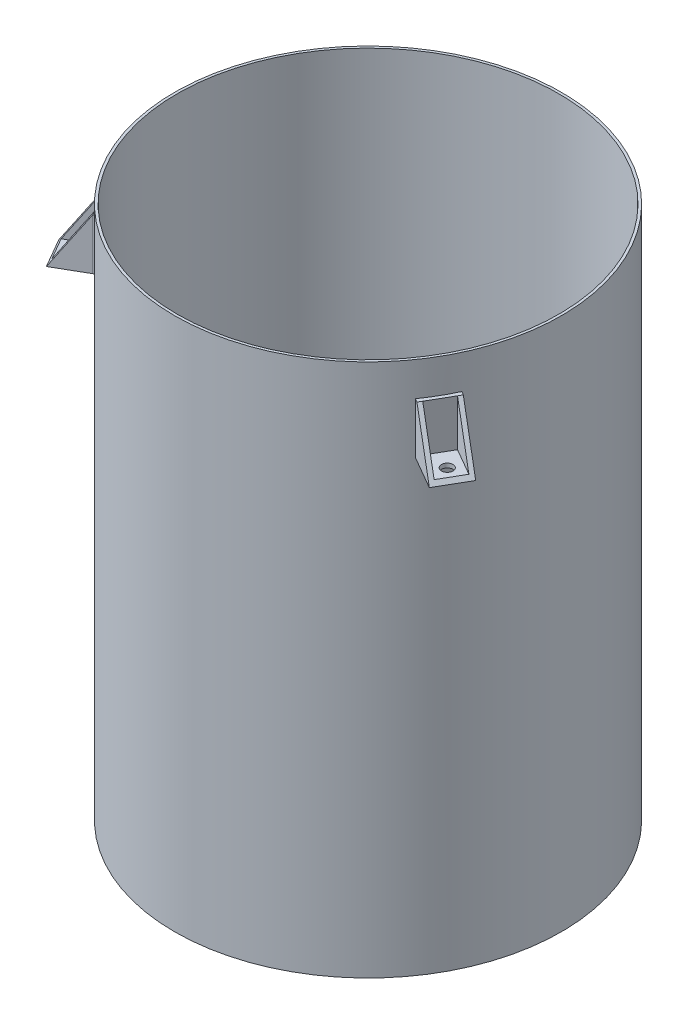
from build123d import *

# Parameters (mm, degrees)
SKETCH1_R                       = 228
SKETCH1_R_2                     = 225
BOSS_EXTRUDE1_DEPTH             = 628.8
SKETCH5_R                       = 28
SKETCH5_R_2                     = 25
BOSS_EXTRUDE2_DEPTH             = 50
BOSS_EXTRUDE2_DIRECTION_2_REACH = 753.49
BOSS_EXTRUDE3_DEPTH             = 60
BOSS_EXTRUDE4_DEPTH             = 40
CUT_EXTRUDE1_DEPTH              = 40
CIRPATTERN1_COUNT               = 3
SKETCH10_R                      = 6.75
CUT_EXTRUDE2_DEPTH              = 40


with BuildPart() as part:
    # Sketch1 → Boss-Extrude1 (new body)
    with BuildSketch(Plane(origin=(0, 0, 0), x_dir=(1, 0, 0), z_dir=(0, 1, 0))):
        with Locations(Location((0, 0, 0), (0, 0, 270))):
            Circle(SKETCH1_R)
        with Locations(Location((0, 0, 0), (0, 0, 270))):
            Circle(SKETCH1_R_2, mode=Mode.SUBTRACT)
    extrude(amount=BOSS_EXTRUDE1_DEPTH)

    # Sketch6 → Boss-Extrude3 (add)
    with BuildSketch(Plane(origin=(0, 528.8, 0), x_dir=(1, 0, 0), z_dir=(0, 1, 0))):
        with BuildLine():
            Line((0, 232.121113065), (20, 232.121113065))
            Line((20, 232.121113065), (20, 227.121113065))
            ThreePointArc((20, 227.121113065), (0, 228), (-20, 227.121113065))
            Line((-20, 227.121113065), (-20, 232.121113065))
            Line((-20, 232.121113065), (0, 232.121113065))
        make_face()
    boss_extrude3 = extrude(amount=BOSS_EXTRUDE3_DEPTH)

    # Sketch7 → Boss-Extrude4 (add)
    with BuildSketch(Plane(origin=(0, 0, -232.121113065), x_dir=(-1, 0, 0), z_dir=(0, 0, -1))):
        Polygon((-20, 588.8), (-20, 528.8), (19.97994018, 528.8), (20, 588.8), (15, 588.8), (15, 533.8), (-15, 533.8), (-15, 588.8), align=None)
    boss_extrude4 = extrude(amount=BOSS_EXTRUDE4_DEPTH)

    # Sketch8 → Cut-Extrude1 (cut)
    with BuildSketch(Plane(origin=(-19.803144086, -0.006620792, 0), x_dir=(0, 0, 1), z_dir=(-0.9999999441116189, -0.0003343303147126472, 0))):
        Polygon((-232.121113065, 588.806653699), (-272.121113065, 528.806650346), (-272.121113065, 588.806653699), align=None)
    cut_extrude1 = extrude(amount=-CUT_EXTRUDE1_DEPTH, mode=Mode.SUBTRACT)

    # CirPattern1: Boss-Extrude3, Boss-Extrude4, Cut-Extrude1 ×3 about axis
    cirpattern1_axis = Axis((0, 0, 0), (0, 1, 0))
    add([boss_extrude3.rotate(cirpattern1_axis, i * 360 / CIRPATTERN1_COUNT) for i in range(1, CIRPATTERN1_COUNT)])
    add([boss_extrude4.rotate(cirpattern1_axis, i * 360 / CIRPATTERN1_COUNT) for i in range(1, CIRPATTERN1_COUNT)])
    add([cut_extrude1.rotate(cirpattern1_axis, i * 360 / CIRPATTERN1_COUNT) for i in range(1, CIRPATTERN1_COUNT)], mode=Mode.SUBTRACT)

    # Sketch10 → Cut-Extrude2 (cut)
    with BuildSketch(Plane(origin=(0, 533.8, 0), x_dir=(1, 0, 0), z_dir=(0, 1, 0))):
        with Locations(Location((0, 255, 0), (0, 0, 270))):
            Circle(SKETCH10_R)
        with Locations(Location((-220.836477965, -127.5, 0), (0, 0, 270))):
            Circle(SKETCH10_R)
        with Locations(Location((220.836477965, -127.5, 0), (0, 0, 270))):
            Circle(SKETCH10_R)
    extrude(amount=-CUT_EXTRUDE2_DEPTH, mode=Mode.SUBTRACT)


with BuildPart() as body_2:
    # Sketch3 → Revolve8 (revolve)
    with BuildSketch(Plane(origin=(0, 0, 0), x_dir=(0, 0, -1), z_dir=(1, 0, 0)), mode=Mode.PRIVATE) as revolve8_sk:
        Polygon((228, 0), (218.885105097, 0), (0, -46.987270791), (0, -50), align=None)
    revolve(revolve8_sk.sketch.rotate(Axis((0, 0, 0), (0, -1, 0)), 180), axis=Axis((0, 0, 0), (0, -1, 0)))

    # Sketch5 → Boss-Extrude2 (add)
    with BuildSketch(Plane(origin=(0, -50, 0), x_dir=(1, 0, 0), z_dir=(0, 1, 0))):
        with Locations(Location((0, 0, 0), (0, 0, 270))):
            Circle(SKETCH5_R)
        with Locations(Location((0, 0, 0), (0, 0, 270))):
            Circle(SKETCH5_R_2, mode=Mode.SUBTRACT)
    extrude(amount=-BOSS_EXTRUDE2_DEPTH)

    # Sketch5 → Boss-Extrude2 direction 2 (add, up to next)
    with BuildSketch(Plane(origin=(0, -50, 0), x_dir=(1, 0, 0), z_dir=(0, 1, 0)), mode=Mode.PRIVATE) as boss_extrude2_direction_2_sk1:
        with Locations(Location((0, 0, 0), (0, 0, 270))):
            Circle(SKETCH5_R)
        with Locations(Location((0, 0, 0), (0, 0, 270))):
            Circle(SKETCH5_R_2, mode=Mode.SUBTRACT)
    boss_extrude2_direction_2_tool1 = extrude(boss_extrude2_direction_2_sk1.sketch, amount=BOSS_EXTRUDE2_DIRECTION_2_REACH, mode=Mode.PRIVATE) - body_2.part
    add(boss_extrude2_direction_2_tool1.solids().sort_by_distance((0, -50, -27.20804))[0])


solid = Compound([part.part, body_2.part])
